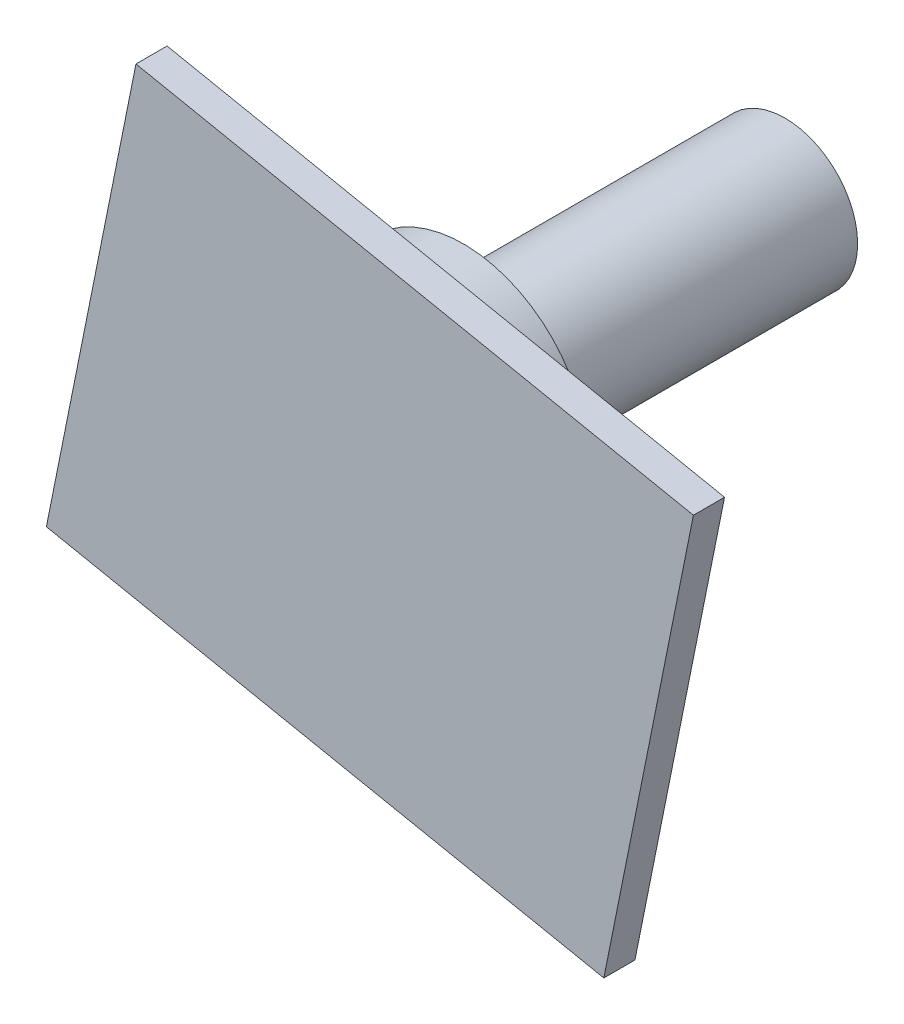
from build123d import *

# Parameters (mm, degrees)
SKETCH_1_R           = 7
EXTRUDE_1_DEPTH      = 34
EXTRUDE_2_DEPTH      = 2
EXTRUDE_2_DEPTH_BACK = 3
SKETCH_2_R           = 12
EXTRUDE_4_DEPTH      = 3


with BuildPart() as part:
    # 草图1 → 凸台-拉伸1 (new body)
    with BuildSketch(Plane.XY):
        with Locations((-86.606649797, -63.783530386)):
            Circle(SKETCH_1_R)
    extrude(amount=EXTRUDE_1_DEPTH)

    # 草图2 → 凸台-拉伸2 (add, two sides: drawn at the far end of the back side and taken through both)
    with BuildSketch(Plane.XY.offset(34).offset(-EXTRUDE_2_DEPTH_BACK)):
        with Locations((-86.606649797, -63.783530386)):
            Circle(SKETCH_2_R)
    extrude(amount=EXTRUDE_2_DEPTH + EXTRUDE_2_DEPTH_BACK)

    # 草图3 → 凸台-拉伸4 (add)
    with BuildSketch(Plane.XY.offset(36)):
        Polygon((-110.176537097, -44.5529439), (-56.43686088, -55.3563008), (-65.07208759, -98.31093904), (-118.811763807, -87.507582139), align=None)
    extrude(amount=EXTRUDE_4_DEPTH)


solid = part.part
